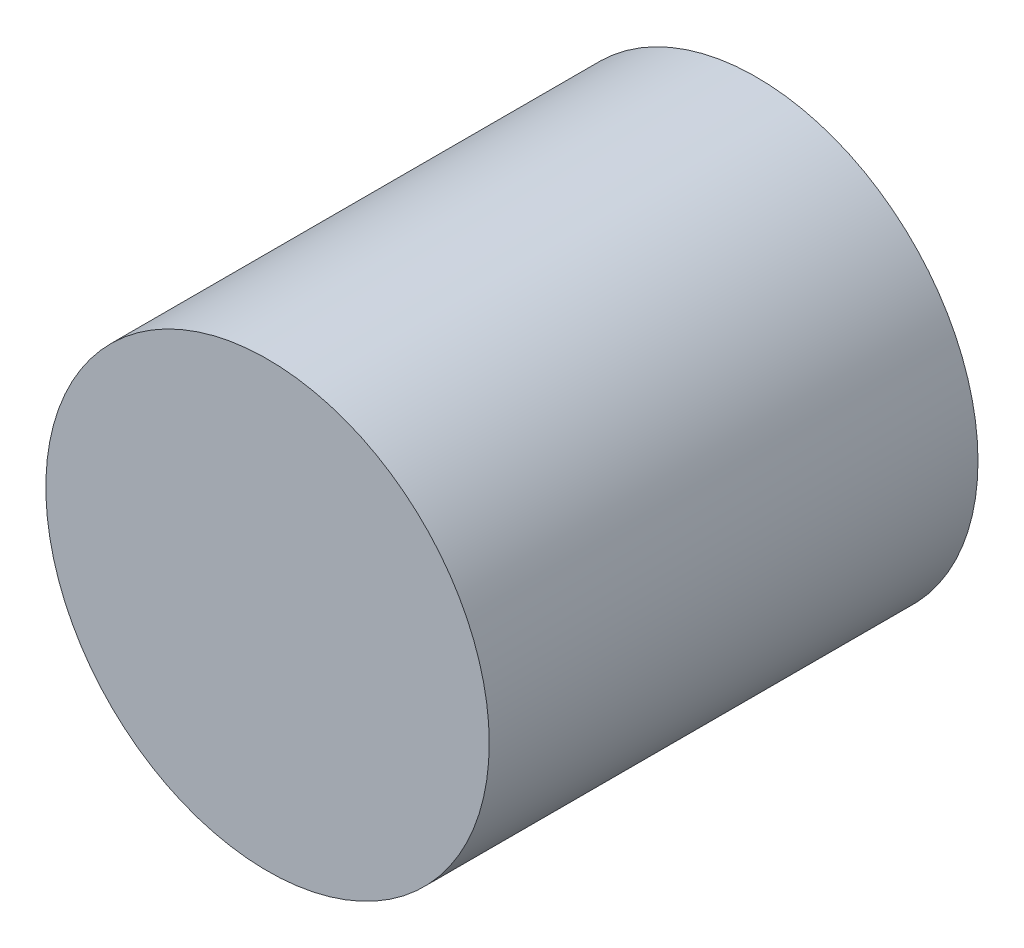
from build123d import *

# Parameters (mm, degrees)
SKETCH1_R           = 9.581625
BOSS_EXTRUDE1_DEPTH = 21.122625


with BuildPart() as part:
    # Sketch1 → Boss-Extrude1 (new body)
    with BuildSketch(Plane.XY):
        with Locations((7.125, -5.675)):
            Circle(SKETCH1_R)
    extrude(amount=BOSS_EXTRUDE1_DEPTH)


solid = part.part
